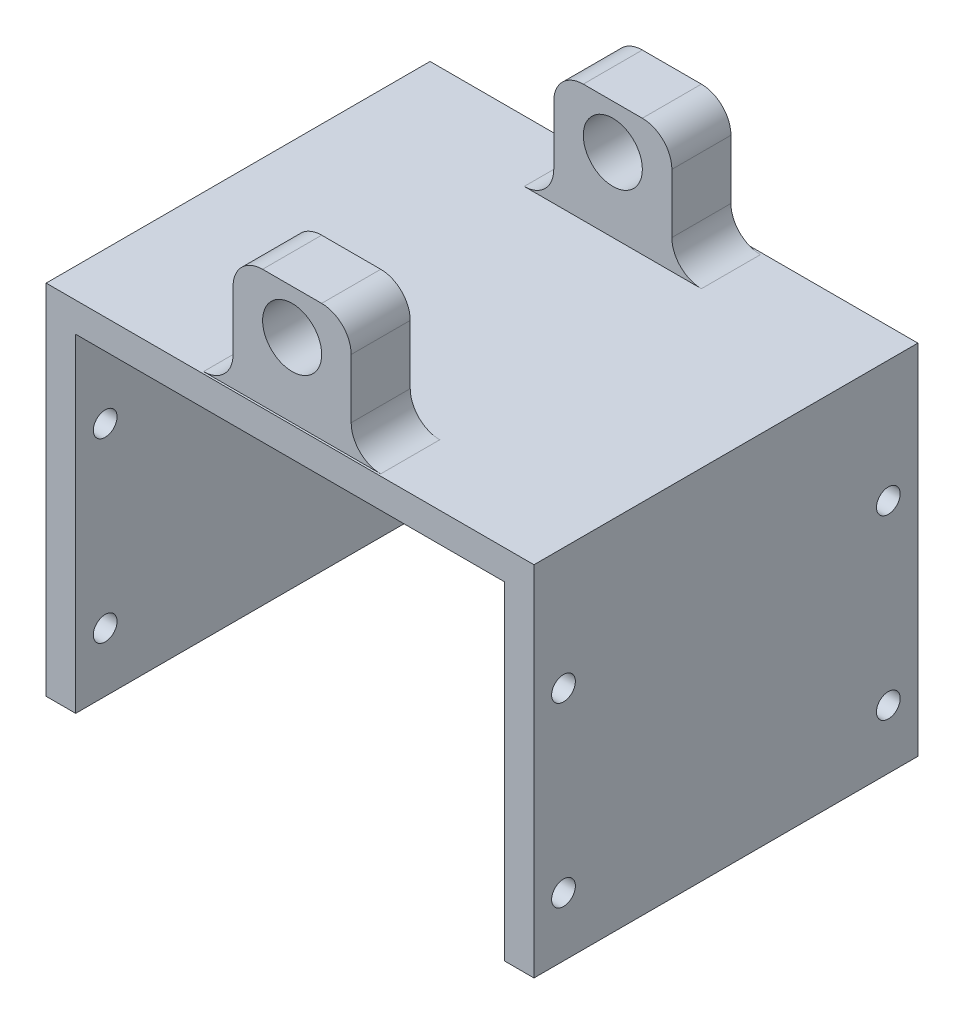
from build123d import *

# Parameters (mm, degrees)
SKETCH1_W                   = 25.4
SKETCH1_H                   = 25.4
SKETCH1_R                   = 6.35
BOSS_EXTRUDE1_DEPTH         = 82.55
FILLET1_R                   = 6.35
SKETCH3_W                   = 136.608571953
SKETCH3_H                   = 27.79521791
SKETCH3_H_2                 = 56.261
SKETCH3_H_3                 = 24.259466636
CUT_EXTRUDE3_DEPTH          = 31.75
TAP_DRILL_FOR_1_4_20_TAP1_D = 5.1054


with BuildPart() as part:
    # Sketch1 → Boss-Extrude1 (new body)
    # profile 1 of 2: a face of its own
    with BuildSketch(Plane.XY):
        with Locations((52.451, 89.662)):
            Rectangle(SKETCH1_W, SKETCH1_H)
        with Locations((52.451, 92.837)):
            Circle(SKETCH1_R, mode=Mode.SUBTRACT)
    # profile 2 of 2: a face of its own
    with BuildSketch(Plane.XY):
        Polygon((6.35, 70.612), (98.552, 70.612), (98.552, 0), (104.902, 0), (104.902, 76.962), (0, 76.962), (0, 0), (6.35, 0), align=None)
    extrude(amount=BOSS_EXTRUDE1_DEPTH)

    # Fillet1
    fillet1_edges = [part.edges().sort_by_distance(p)[0] for p in [
        (65.151, 76.962, 41.275),
        (39.751, 76.962, 41.275),
        (39.751, 102.362, 41.275),
        (65.151, 102.362, 41.275),
    ]]
    fillet(fillet1_edges, radius=FILLET1_R)

    # Sketch3 → Cut-Extrude3 (cut)
    with BuildSketch(Plane(origin=(0, 108.712, 0), x_dir=(1, 0, 0), z_dir=(0, 1, 0))):
        with Locations((56.578258919, 13.453108955)):
            Rectangle(SKETCH3_W, SKETCH3_H)
        with Locations((56.578258919, -41.275)):
            Rectangle(SKETCH3_W, SKETCH3_H_2)
        with Locations((56.578258919, -94.235233318)):
            Rectangle(SKETCH3_W, SKETCH3_H_3)
    extrude(amount=-CUT_EXTRUDE3_DEPTH, mode=Mode.SUBTRACT)

    # Tap Drill for 1/4-20 Tap1 (through all)
    with Locations(Plane.ZY):
        with Locations((6.35, 50.8), (6.35, 12.7), (76.2, 12.7), (76.2, 50.8)):
            Hole(TAP_DRILL_FOR_1_4_20_TAP1_D / 2)


solid = part.part
